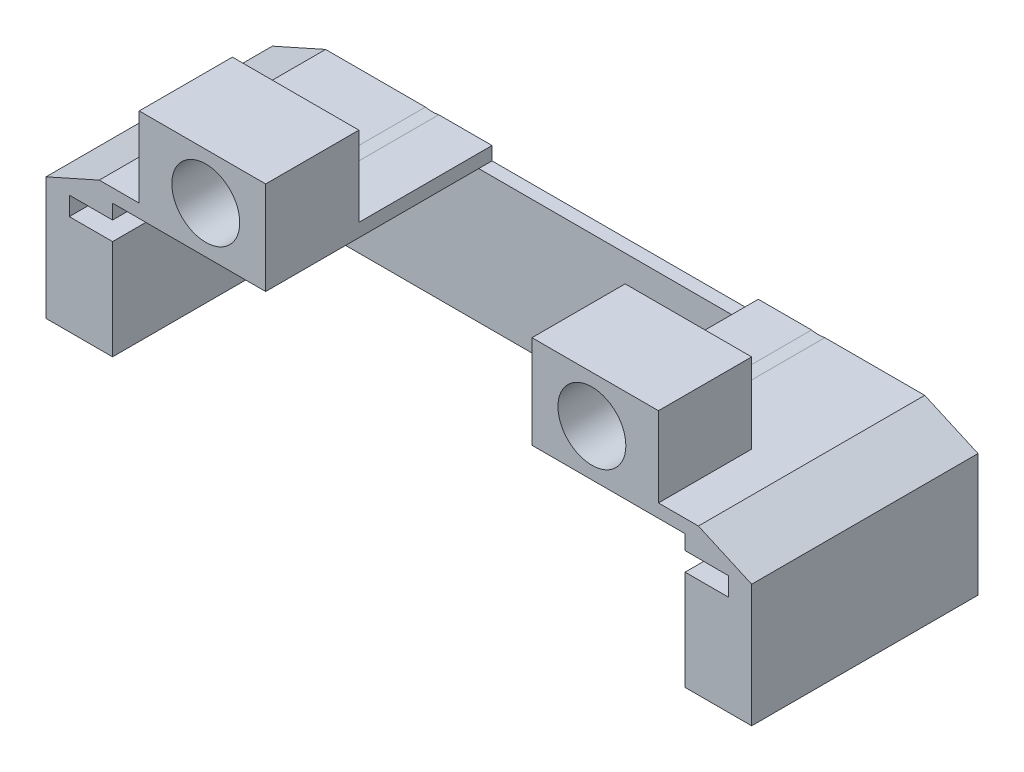
from build123d import *

# Parameters (mm, degrees)
CROQUIS1_W              = 51
CROQUIS1_H              = 17
SALIENTE_EXTRUIR1_DEPTH = 17
CROQUIS2_W              = 15
CROQUIS2_H              = 16
CORTAR_EXTRUIR1_DEPTH   = 17
CROQUIS3_W              = 43
CROQUIS3_H              = 10
CORTAR_EXTRUIR2_DEPTH   = 16
CORTAR_EXTRUIR3_START   = -17
CROQUIS5_R              = 2.55
CORTAR_EXTRUIR3_DEPTH   = 17
CROQUIS6_W              = 49.5
CROQUIS6_H              = 1.4
CORTAR_EXTRUIR4_DEPTH   = 16
CORTAR_EXTRUIR5_START   = -17
CROQUIS7_W              = 6
CROQUIS7_H              = 6
CROQUIS7_W_2            = 20
CROQUIS7_H_2            = 7
CORTAR_EXTRUIR5_DEPTH   = 17
CORTAR_EXTRUIR6_START   = -39
CROQUIS8_W              = 10
CROQUIS8_H              = 6
CORTAR_EXTRUIR6_DEPTH   = 39
CROQUIS10_W             = 17
CROQUIS10_H             = 11
SALIENTE_EXTRUIR4_DEPTH = 1
CROQUIS11_W             = 17
CROQUIS11_H             = 11
SALIENTE_EXTRUIR5_DEPTH = 1
CORTAR_EXTRUIR7_START   = -17
CORTAR_EXTRUIR7_DEPTH   = 17


with BuildPart() as part:
    # Croquis1 → Saliente-Extruir1 (new body)
    with BuildSketch(Plane.XY):
        with Locations((-29.407991935, 18.612308998)):
            Rectangle(CROQUIS1_W, CROQUIS1_H)
    extrude(amount=SALIENTE_EXTRUIR1_DEPTH)

    # Croquis2 → Cortar-Extruir1 (cut)
    with BuildSketch(Plane.XZ.offset(-10.112308998)):
        with Locations((-29.407991935, 9)):
            Rectangle(CROQUIS2_W, CROQUIS2_H)
    extrude(amount=-CORTAR_EXTRUIR1_DEPTH, mode=Mode.SUBTRACT)

    # Croquis3 → Cortar-Extruir2 (cut)
    with BuildSketch(Plane.XY.offset(17)):
        with Locations((-29.407991935, 15.112308998)):
            Rectangle(CROQUIS3_W, CROQUIS3_H)
    extrude(amount=-CORTAR_EXTRUIR2_DEPTH, mode=Mode.SUBTRACT)

    # Croquis5 → Cortar-Extruir3 (cut)
    with BuildSketch(Plane.XY.offset(17).offset(CORTAR_EXTRUIR3_START)):
        with Locations((-43.907991935, 23.612308998)):
            Circle(CROQUIS5_R)
        with Locations((-14.907991935, 23.612308998)):
            Circle(CROQUIS5_R)
    extrude(amount=CORTAR_EXTRUIR3_DEPTH, mode=Mode.SUBTRACT)

    # Croquis6 → Cortar-Extruir4 (cut)
    with BuildSketch(Plane.XY.offset(17)):
        with Locations((-29.407991935, 18.312308998)):
            Rectangle(CROQUIS6_W, CROQUIS6_H)
    extrude(amount=-CORTAR_EXTRUIR4_DEPTH, mode=Mode.SUBTRACT)

    # Croquis7 → Cortar-Extruir5 (cut)
    with BuildSketch(Plane.XY.offset(17).offset(CORTAR_EXTRUIR5_START)):
        with Locations((-6.907991935, 24.112308998)):
            Rectangle(CROQUIS7_W, CROQUIS7_H)
        with Locations((-51.907991935, 24.112308998)):
            Rectangle(CROQUIS7_W, CROQUIS7_H)
        with Locations((-29.407991935, 23.612308998)):
            Rectangle(CROQUIS7_W_2, CROQUIS7_H_2)
    extrude(amount=CORTAR_EXTRUIR5_DEPTH, mode=Mode.SUBTRACT)

    # Croquis8 → Cortar-Extruir6 (cut)
    with BuildSketch(Plane(origin=(-9.907991935, 0, 0), x_dir=(0, 0, -1), z_dir=(1, 0, 0)).offset(CORTAR_EXTRUIR6_START)):
        with Locations((-5, 24.112308998)):
            Rectangle(CROQUIS8_W, CROQUIS8_H)
    extrude(amount=CORTAR_EXTRUIR6_DEPTH, mode=Mode.SUBTRACT)

    # Croquis10 → Saliente-Extruir4 (add)
    with BuildSketch(Plane.ZY.offset(54.907991935)):
        with Locations((8.5, 15.612308998)):
            Rectangle(CROQUIS10_W, CROQUIS10_H)
    extrude(amount=SALIENTE_EXTRUIR4_DEPTH)

    # Croquis11 → Saliente-Extruir5 (add)
    with BuildSketch(Plane(origin=(-3.907991935, 0, 0), x_dir=(0, 0, -1), z_dir=(1, 0, 0))):
        with Locations((-8.5, 15.612308998)):
            Rectangle(CROQUIS11_W, CROQUIS11_H)
    extrude(amount=SALIENTE_EXTRUIR5_DEPTH)

    # Croquis12 → Cortar-Extruir7 (cut)
    with BuildSketch(Plane.XY.offset(17).offset(CORTAR_EXTRUIR7_START)):
        Polygon((-55.907991935, 21.112308998), (-51.907991935, 21.112308998), (-55.907991935, 19.325976361), align=None)
        Polygon((-2.907991935, 21.112308998), (-6.907991935, 21.112308998), (-2.907991935, 19.325976361), align=None)
    extrude(amount=CORTAR_EXTRUIR7_DEPTH, mode=Mode.SUBTRACT)


solid = part.part
